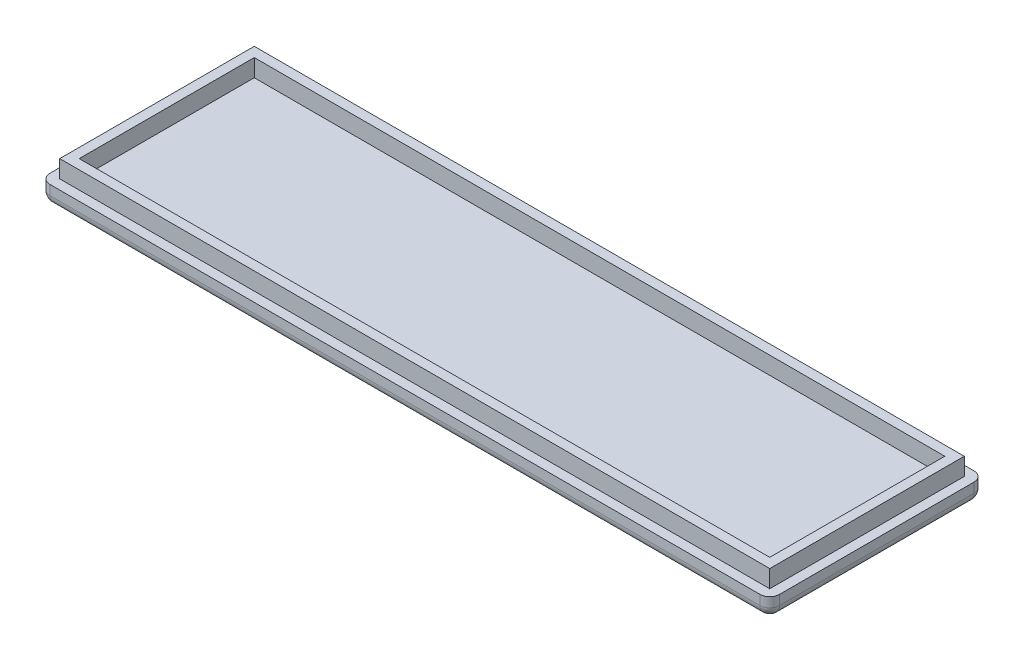
from build123d import *

# Parameters (mm, degrees)
SKETCH1_W           = 75
SKETCH1_H           = 22
BOSS_EXTRUDE1_DEPTH = 2
SKETCH2_W           = 73
SKETCH2_H           = 20
SKETCH2_W_2         = 71
SKETCH2_H_2         = 18
BOSS_EXTRUDE2_DEPTH = 1.8
FILLET2_R           = 1


with BuildPart() as part:
    # Sketch1 → Boss-Extrude1 (new body)
    with BuildSketch(Plane(origin=(0, 0, 0), x_dir=(1, 0, 0), z_dir=(0, 1, 0))):
        Rectangle(SKETCH1_W, SKETCH1_H)
    extrude(amount=BOSS_EXTRUDE1_DEPTH)

    # Sketch2 → Boss-Extrude2 (add)
    with BuildSketch(Plane(origin=(0, 2, 0), x_dir=(1, 0, 0), z_dir=(0, 1, 0))):
        Rectangle(SKETCH2_W, SKETCH2_H)
        Rectangle(SKETCH2_W_2, SKETCH2_H_2, mode=Mode.SUBTRACT)
    extrude(amount=BOSS_EXTRUDE2_DEPTH)

    # Fillet2
    fillet2_edges = [part.edges().sort_by_distance(p)[0] for p in [
        (0, 0, 11),
        (-37.5, 0, 0),
        (0, 0, -11),
        (37.5, 0, 0),
        (37.5, 1, 11),
        (-37.5, 1, 11),
        (-37.5, 1, -11),
        (37.5, 1, -11),
    ]]
    fillet(fillet2_edges, radius=FILLET2_R)


solid = part.part
